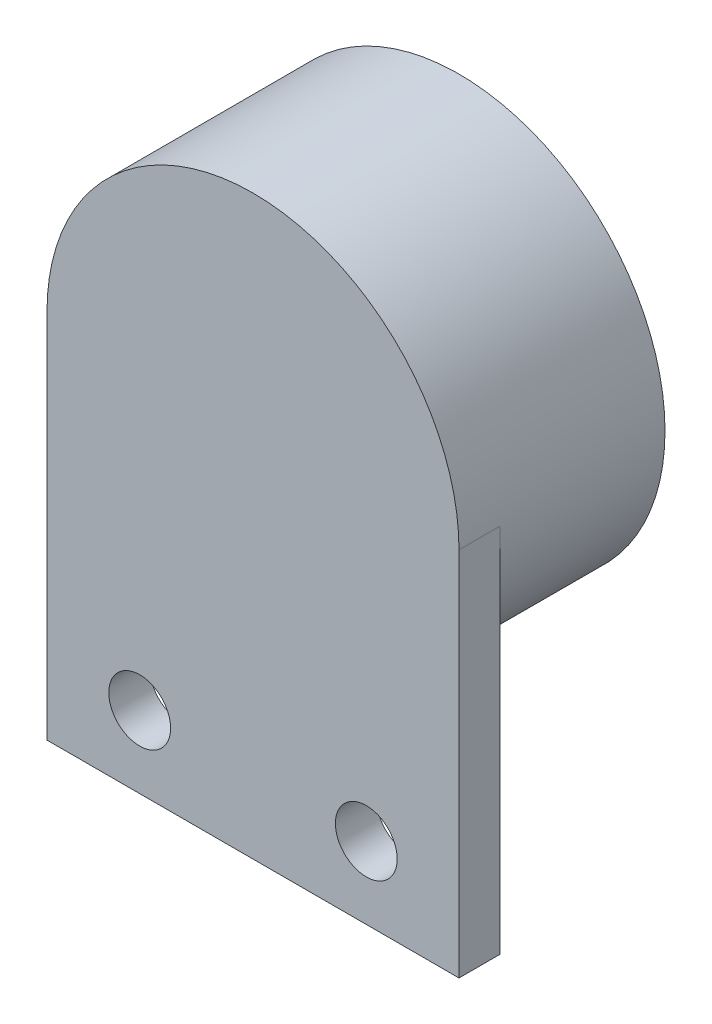
from build123d import *

# Parameters (mm, degrees)
SKETCH1_R           = 10
BOSS_EXTRUDE1_DEPTH = 10
SKETCH2_W           = 20
SKETCH2_H           = 18
BOSS_EXTRUDE2_DEPTH = 2
SKETCH3_R           = 1
BOSS_EXTRUDE3_DEPTH = 2
SKETCH5_R           = 1.5
CUT_EXTRUDE1_DEPTH  = 2


with BuildPart() as part:
    # Sketch1 → Boss-Extrude1 (new body)
    with BuildSketch(Plane.XY):
        Circle(SKETCH1_R)
    extrude(amount=BOSS_EXTRUDE1_DEPTH)

    # Sketch2 → Boss-Extrude2 (add)
    with BuildSketch(Plane.XY.offset(10)):
        with Locations((0, -9)):
            Rectangle(SKETCH2_W, SKETCH2_H)
    extrude(amount=-BOSS_EXTRUDE2_DEPTH)

    # Sketch3 → Boss-Extrude3 (add)
    with BuildSketch(Plane(origin=(0, 0, 0), x_dir=(-1, 0, 0), z_dir=(0, 0, -1))):
        with Locations(Location((0, 0, 0), (0, 0, 180))):
            Circle(SKETCH3_R)
    extrude(amount=BOSS_EXTRUDE3_DEPTH)

    # Sketch5 → Cut-Extrude1 (cut)
    with BuildSketch(Plane(origin=(0, 0, 8), x_dir=(-1, 0, 0), z_dir=(0, 0, -1))):
        with Locations((-5.5, -14.5)):
            Circle(SKETCH5_R)
        with Locations((5.5, -14.5)):
            Circle(SKETCH5_R)
    extrude(amount=-CUT_EXTRUDE1_DEPTH, mode=Mode.SUBTRACT)


solid = part.part
